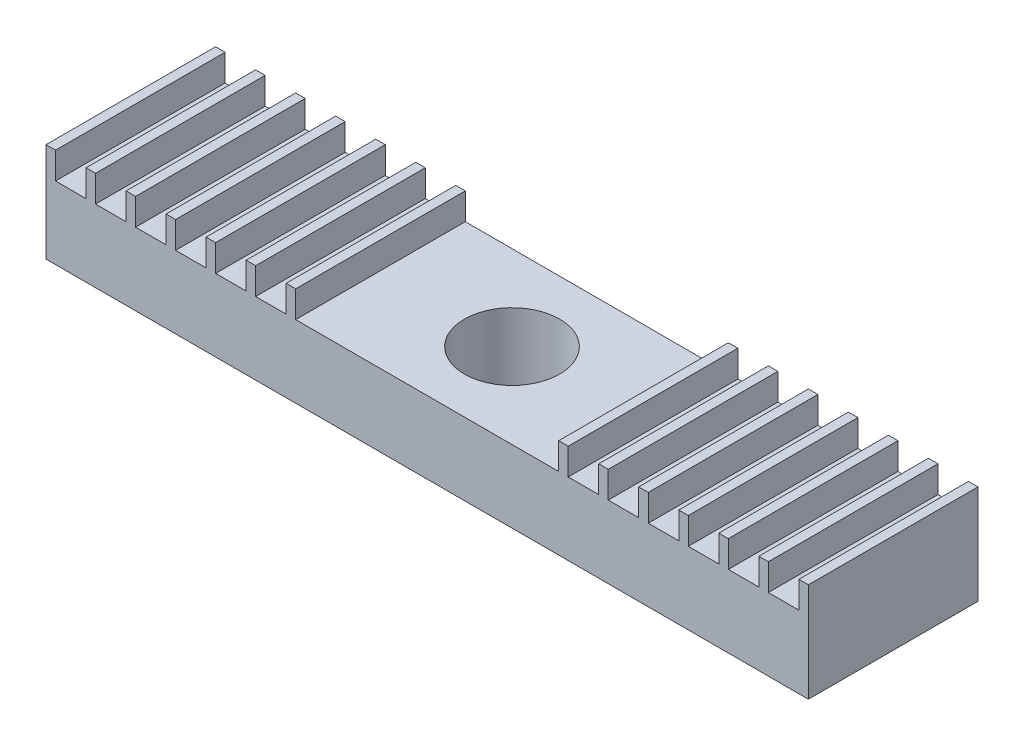
from build123d import *

# Parameters (mm, degrees)
SKETCH1_W           = 20
SKETCH1_H           = 3.8
BOSS_EXTRUDE1_DEPTH = 4.45
SKETCH2_W           = 0.5
SKETCH2_H           = 8.9
BOSS_EXTRUDE2_DEPTH = 1.4
LPATTERN1_COUNT     = 7
LPATTERN1_PITCH     = 2.1
SKETCH3_R           = 2.5
CUT_EXTRUDE1_DEPTH  = 21.838486029


with BuildPart() as part:
    # Sketch1 → Boss-Extrude1 (new, symmetric)
    with BuildSketch(Plane.XY):
        with Locations((-10, 1.9)):
            Rectangle(SKETCH1_W, SKETCH1_H)
    extrude(amount=BOSS_EXTRUDE1_DEPTH, both=True)

    # Sketch2 → Boss-Extrude2 (add)
    with BuildSketch(Plane(origin=(0, 3.8, 0), x_dir=(1, 0, 0), z_dir=(0, 1, 0))):
        with Locations((-19.75, 0)):
            Rectangle(SKETCH2_W, SKETCH2_H)
    boss_extrude2 = extrude(amount=BOSS_EXTRUDE2_DEPTH)

    # LPattern1: Boss-Extrude2 ×7
    with Locations(*[(i * LPATTERN1_PITCH, 0, 0) for i in range(1, LPATTERN1_COUNT)]):
        add(boss_extrude2)

    # Mirror1: part across plane


with BuildPart() as part_1:
    add(part.part)
    add(part.part.mirror(Plane(origin=(0, 0, 4.45), x_dir=(0, 0, 1), z_dir=(-1, 0, 0))))

    # Sketch3 → Cut-Extrude1 (cut, through all)
    with BuildSketch(Plane(origin=(0, 3.8, 0), x_dir=(1, 0, 0), z_dir=(0, 1, 0))):
        with Locations(Location((0, 0, 0), (0, 0, 180))):
            Circle(SKETCH3_R)
    extrude(amount=-CUT_EXTRUDE1_DEPTH, mode=Mode.SUBTRACT)


solid = part_1.part
